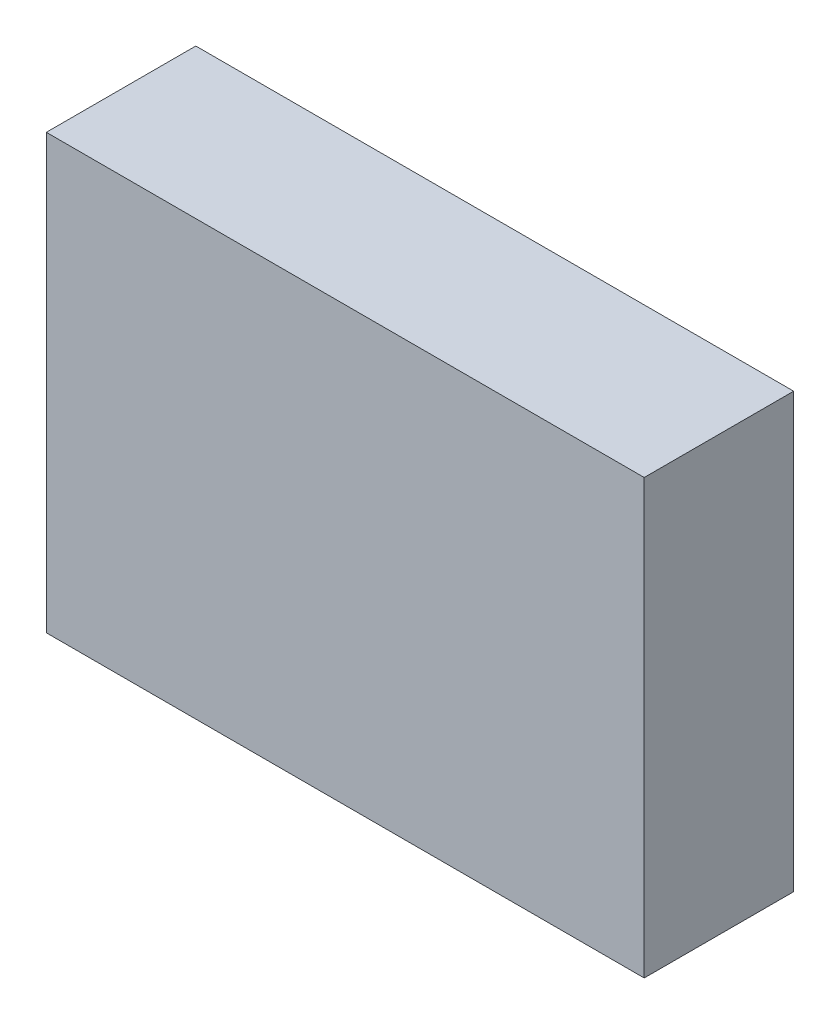
from build123d import *

# Parameters (mm, degrees)
SKETCH1_W           = 40
SKETCH1_H           = 29
BOSS_EXTRUDE1_DEPTH = 10


with BuildPart() as part:
    # Sketch1 → Boss-Extrude1 (new body)
    with BuildSketch(Plane.XY):
        with Locations((20, 14.5)):
            Rectangle(SKETCH1_W, SKETCH1_H)
    extrude(amount=BOSS_EXTRUDE1_DEPTH)


solid = part.part
